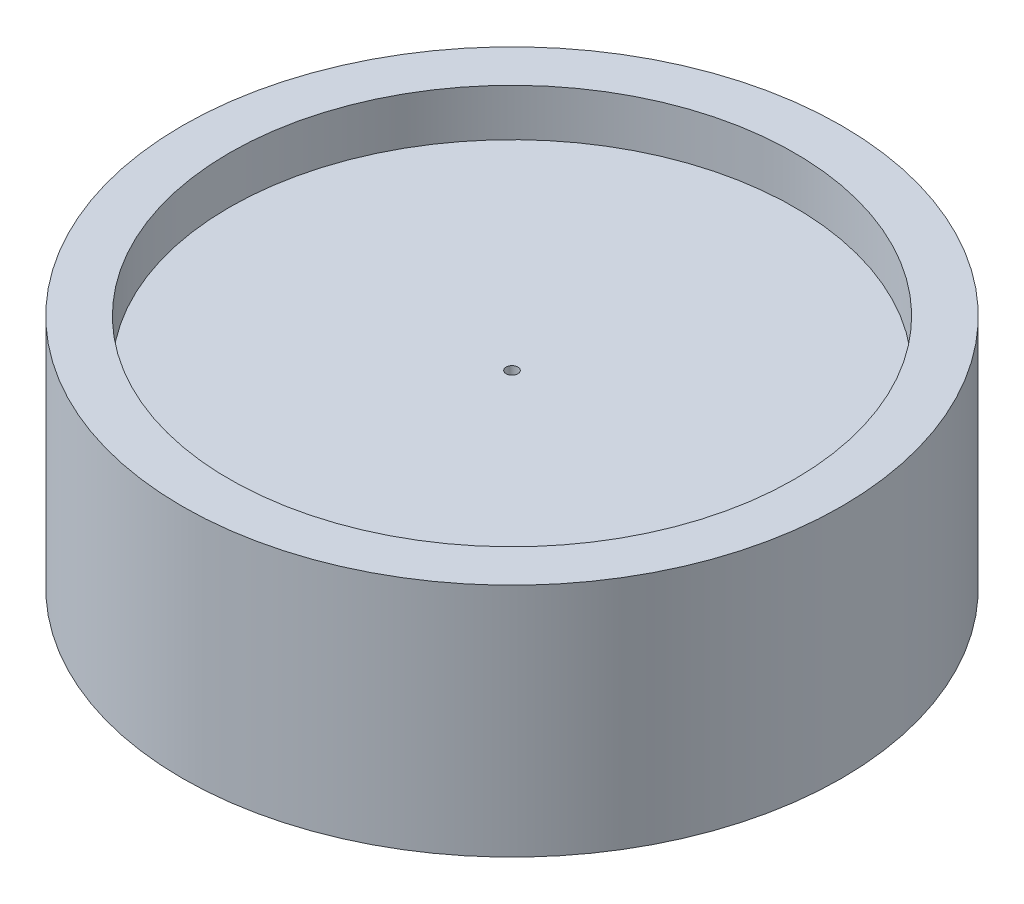
from build123d import *

# Parameters (mm, degrees)
SKETCH3_R                       = 1
HOLE_FOR_SCREW_BLADE_CASE_DEPTH = 100


with BuildPart() as part:
    # Sketch2 → Blade Casing Revolve (revolve)
    with BuildSketch(Plane.XY):
        Polygon((0, 0), (48, 0), (48, 8), (56, 8), (56, -32), (48, -32), (48, -12), (0, -12), align=None)
    revolve(axis=Axis((0, -12, 0), (0, 1, 0)))

    # Sketch3 → Hole for Screw (Blade Case) (cut)
    with BuildSketch(Plane(origin=(0, 0, 0), x_dir=(1, 0, 0), z_dir=(0, 1, 0))):
        with Locations(Location((0, 0, 0), (0, 0, 180))):
            Circle(SKETCH3_R)
    extrude(amount=-HOLE_FOR_SCREW_BLADE_CASE_DEPTH, mode=Mode.SUBTRACT)


solid = part.part
